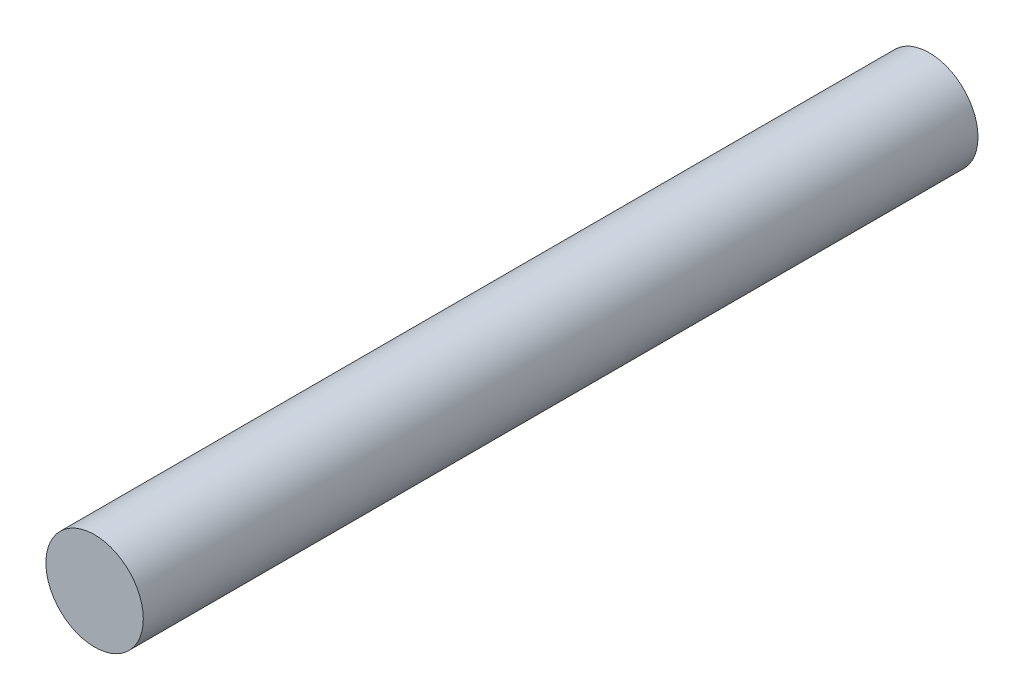
from build123d import *

# Parameters (mm, degrees)
KAP_HELEZON_POM_D70_START = -100
SKETCH1_R                 = 35
KAP_HELEZON_POM_D70_DEPTH = 600


with BuildPart() as part:
    # Sketch1 → KAP_helezon_POM_D70 (new body)
    with BuildSketch(Plane.XY.offset(KAP_HELEZON_POM_D70_START)):
        with Locations((0, 68)):
            Circle(SKETCH1_R)
    extrude(amount=-KAP_HELEZON_POM_D70_DEPTH)


solid = part.part
